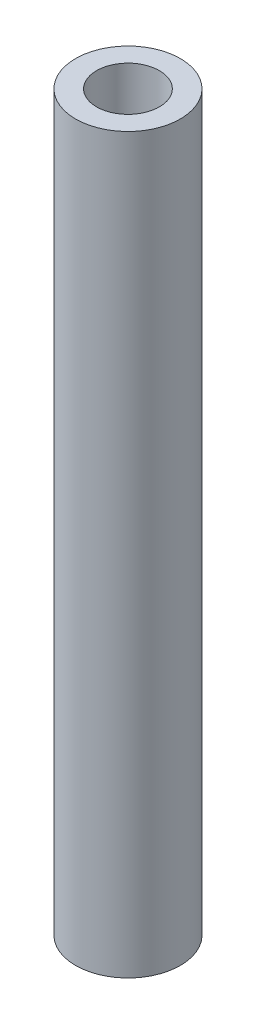
from build123d import *

# Parameters (mm, degrees)
CROQUIS1_R              = 2.5
SALIENTE_EXTRUIR1_DEPTH = 35
CROQUIS2_R              = 1.5
CORTAR_EXTRUIR1_DEPTH   = 35


with BuildPart() as part:
    # Croquis1 → Saliente-Extruir1 (new body)
    with BuildSketch(Plane(origin=(0, 0, 0), x_dir=(1, 0, 0), z_dir=(0, 1, 0))):
        with Locations(Location((0, 0, 0), (0, 0, 270))):
            Circle(CROQUIS1_R)
    extrude(amount=SALIENTE_EXTRUIR1_DEPTH)

    # Croquis2 → Cortar-Extruir1 (cut)
    with BuildSketch(Plane(origin=(0, 35, 0), x_dir=(1, 0, 0), z_dir=(0, 1, 0))):
        with Locations(Location((0, 0, 0), (0, 0, 270))):
            Circle(CROQUIS2_R)
    extrude(amount=-CORTAR_EXTRUIR1_DEPTH, mode=Mode.SUBTRACT)


solid = part.part
